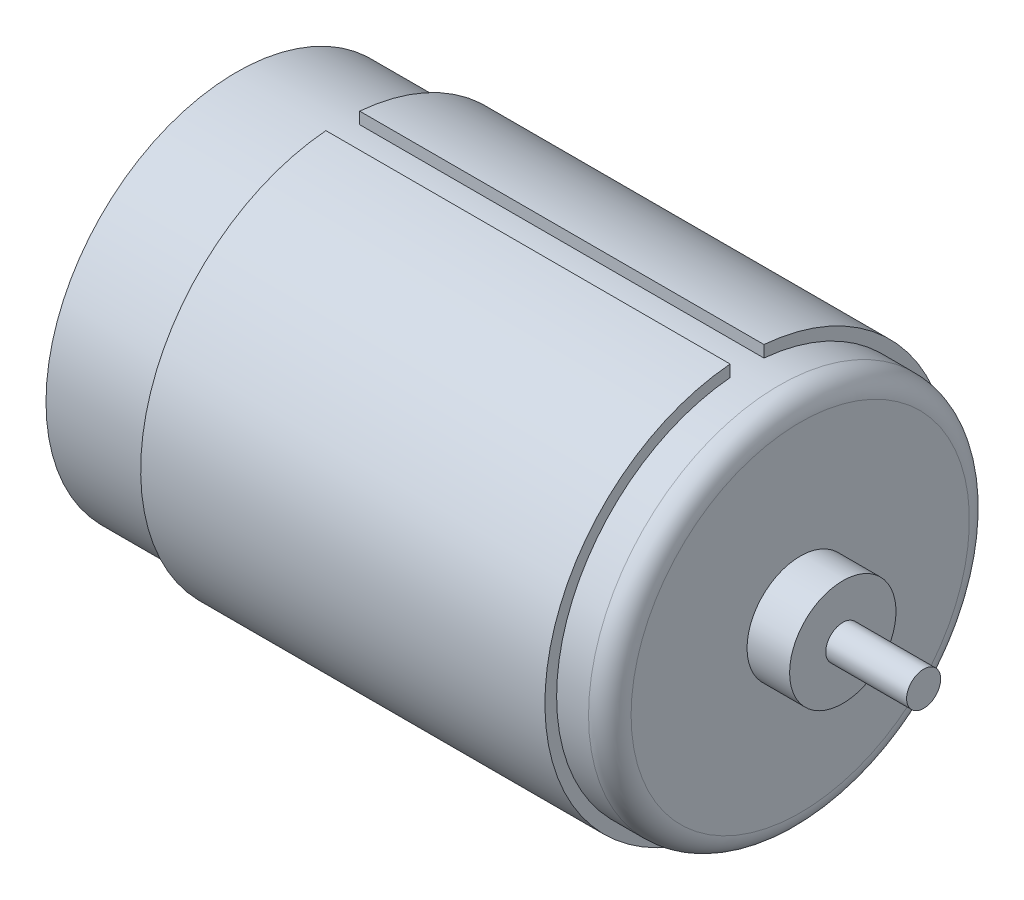
from build123d import *

# Parameters (mm, degrees)
CUT_EXTRUDE1_REACH = 62.854


with BuildPart() as part:
    # Sketch3 → Revolve1 (revolve)
    with BuildSketch(Plane.XY, mode=Mode.PRIVATE) as revolve1_sk:
        with BuildLine():
            Line((0, 0), (0, 17.9))
            Line((0, 17.9), (10, 17.9))
            Line((10, 17.9), (10, 19))
            Line((10, 19), (48, 19))
            Line((48, 19), (48, 17.9))
            Line((48, 17.9), (51, 17.9))
            ThreePointArc((51, 17.9), (52.414213562, 17.314213562), (53, 15.9))
            Line((53, 15.9), (53, 5))
            Line((53, 5), (57, 5))
            Line((57, 5), (57, 1.6))
            Line((57, 1.6), (64.6, 1.6))
            Line((64.6, 1.6), (64.6, 0))
            Line((64.6, 0), (49.67547572, 0))
            Line((49.67547572, 0), (49.67547572, 14.100571752))
            Line((49.67547572, 14.100571752), (3.511968533, 14.100571752))
            Line((3.511968533, 14.100571752), (3.511968533, 0))
            Line((3.511968533, 0), (0, 0))
        make_face()
    revolve(revolve1_sk.sketch.rotate(Axis((0, 0, 0), (1, 0, 0)), 90), axis=Axis((0, 0, 0), (1, 0, 0)))

    # Sketch4 → Cut-Extrude1 (cut, up to next)
    with BuildSketch(Plane.ZY.offset(-10), mode=Mode.PRIVATE) as cut_extrude1_sk1:
        with BuildLine():
            Line((1.5875, 18.933563947), (1.5875, 17.829465605))
            ThreePointArc((1.5875, 17.829465605), (0, 17.9), (-1.5875, 17.829465605))
            Line((-1.5875, 17.829465605), (-1.5875, 18.933563947))
            ThreePointArc((-1.5875, 18.933563947), (0, 19), (1.5875, 18.933563947))
        make_face()
    cut_extrude1_tool1 = extrude(cut_extrude1_sk1.sketch, amount=-CUT_EXTRUDE1_REACH, mode=Mode.PRIVATE) & part.part
    add(cut_extrude1_tool1.solids().sort_by_distance((10, 18.427166, 0))[0], mode=Mode.SUBTRACT)


solid = part.part
